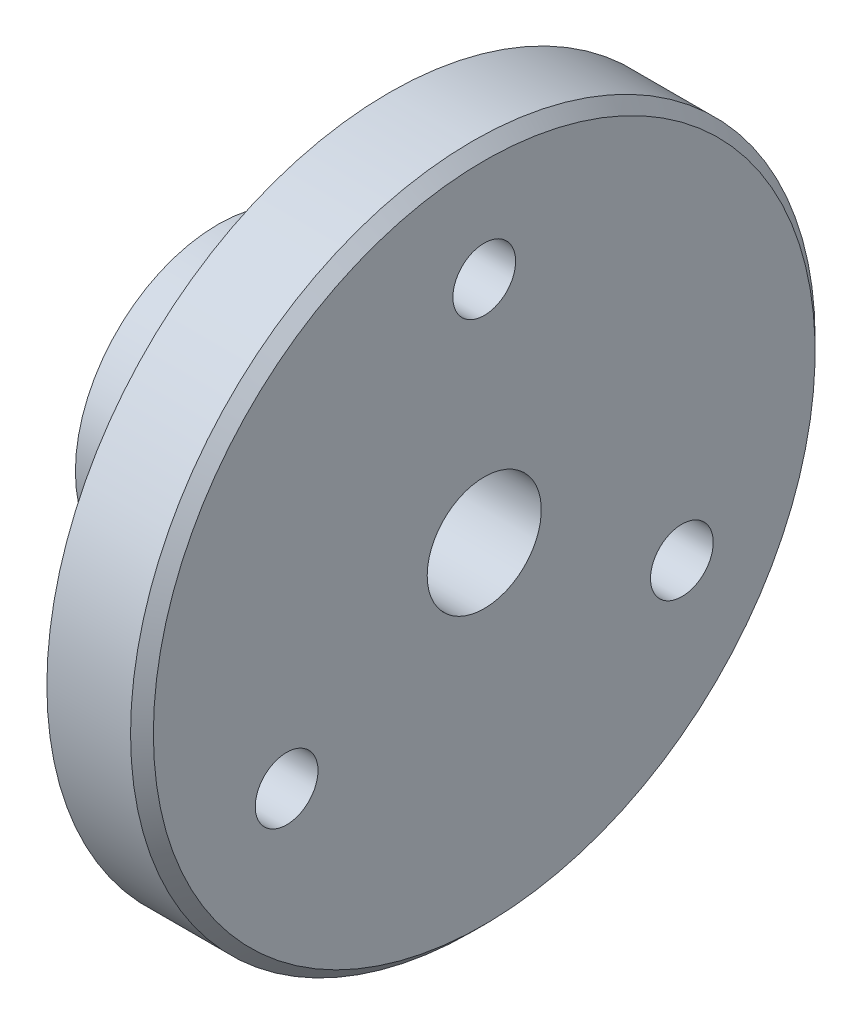
from build123d import *

# Parameters (mm, degrees)
ESQUISSE2_R                  = 1.25
ENL_V_MAT_EXTRU_1_DEPTH      = 30.051678093
TROU_TARAUD_M41_D            = 3.3
R_P_TITION_CIRCULAIRE1_COUNT = 3
CHANFREIN1_SIZE              = 0.6


with BuildPart() as part:
    # Esquisse1 → Révolution1 (revolve)
    with BuildSketch(Plane.XY, mode=Mode.PRIVATE) as r_volution1_sk:
        Polygon((0, 3), (14, 3), (14, 18), (9, 18), (9, 7.5), (0, 7.5), align=None)
    revolve(r_volution1_sk.sketch.rotate(Axis((0, 0, 0), (1, 0, 0)), 90), axis=Axis((0, 0, 0), (1, 0, 0)))

    # Esquisse2 → Enlèv. mat.-Extru.1 (cut, through all)
    with BuildSketch(Plane.XY):
        with Locations((6, 0)):
            Circle(ESQUISSE2_R)
    extrude(amount=-ENL_V_MAT_EXTRU_1_DEPTH, mode=Mode.SUBTRACT)

    # Trou taraudé M41 (through all)
    with Locations(Plane(origin=(14, 0, 0), x_dir=(0, 0, -1), z_dir=(1, 0, 0))):
        with Locations((0, 12)):
            trou_taraud_m41 = Hole(TROU_TARAUD_M41_D / 2)

    # Répétition circulaire1: Trou taraudé M41 ×3 about axis
    r_p_tition_circulaire1_axis = Axis((0, 0, 0), (1, 0, 0))
    for i in range(1, R_P_TITION_CIRCULAIRE1_COUNT):
        add(trou_taraud_m41.rotate(r_p_tition_circulaire1_axis, i * 360 / R_P_TITION_CIRCULAIRE1_COUNT), mode=Mode.SUBTRACT)

    # Chanfrein1
    chanfrein1_edges = [part.edges().sort_by_distance(p)[0] for p in [
        (14, 0, -18),
    ]]
    chamfer(chanfrein1_edges, length=CHANFREIN1_SIZE)


solid = part.part
